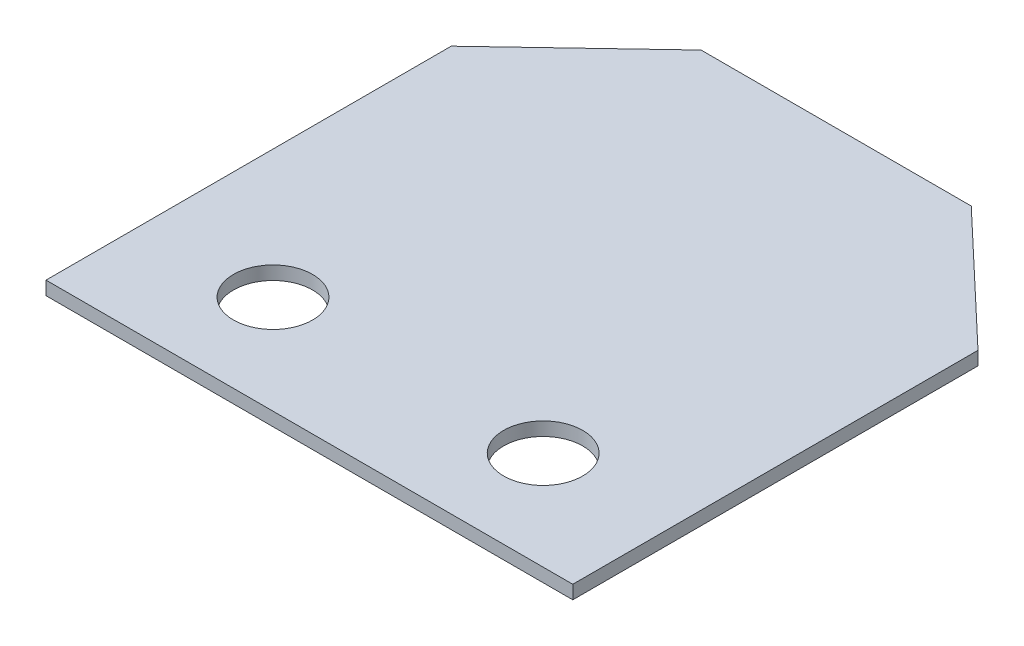
from build123d import *

# Parameters (mm, degrees)
ESBO_O1_R                = 5.857023813
RESSALTO_EXTRUS_O1_DEPTH = 2


with BuildPart() as part:
    # Esboço1 → Ressalto-extrusão1 (new body)
    with BuildSketch(Plane(origin=(0, 0, 0), x_dir=(1, 0, 0), z_dir=(0, 1, 0))):
        Polygon((-20, 48), (-39, 30), (-39, -30), (39, -30), (39, 30), (20, 48), align=None)
        with Locations(Location((-20, -15.384615385, 0), (0, 0, 270))):
            Circle(ESBO_O1_R, mode=Mode.SUBTRACT)
        with Locations(Location((20, -15.384615385, 0), (0, 0, 90))):
            Circle(ESBO_O1_R, mode=Mode.SUBTRACT)
    extrude(amount=RESSALTO_EXTRUS_O1_DEPTH)


solid = part.part
